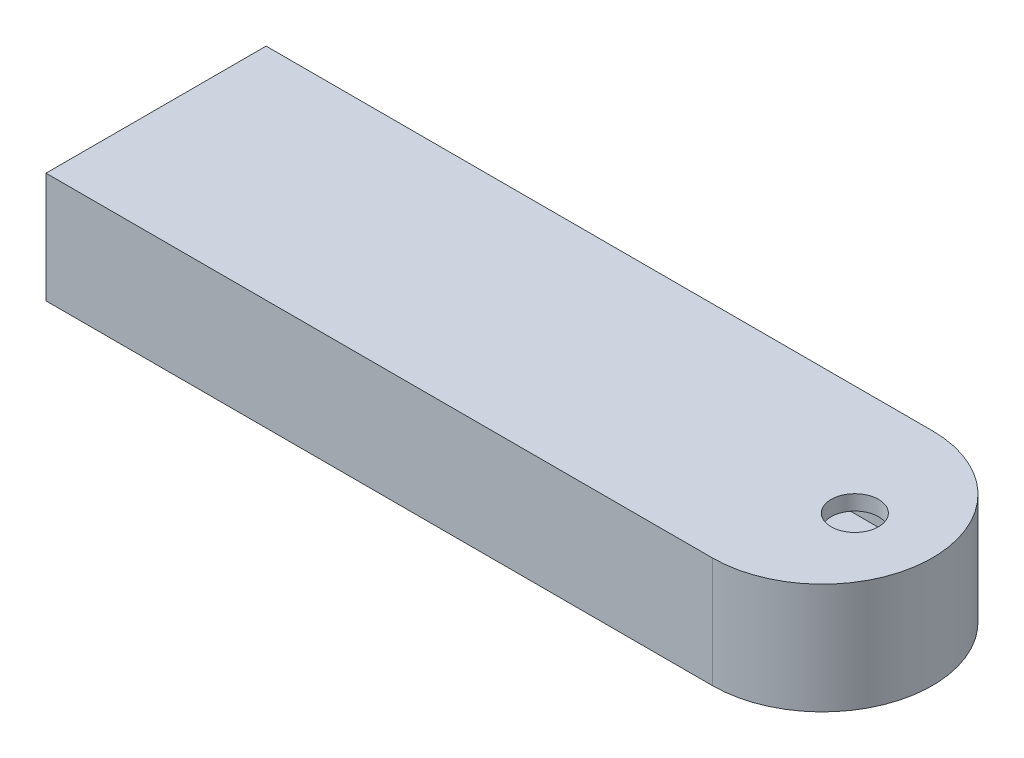
from build123d import *

# Parameters (mm, degrees)
SKETCH1_R           = 3.155
BOSS_EXTRUDE7_DEPTH = 14.7
SHELL1_T            = -2
CUT_EXTRUDE5_REACH  = 107.459
SKETCH4_W           = 25.25
SKETCH4_H           = 10.7


with BuildPart() as part:
    # Sketch1 → Boss-Extrude7 (new body)
    with BuildSketch(Plane(origin=(0, 0, 0), x_dir=(1, 0, 0), z_dir=(0, 1, 0))):
        with BuildLine():
            Line((-59.361665301, -13.110958237), (29.188334699, -13.110958237))
            ThreePointArc((29.188334699, -13.110958237), (43.813334699, 1.514041763), (29.188334699, 16.139041763))
            Line((29.188334699, 16.139041763), (-59.361665301, 16.139041763))
            Line((-59.361665301, 16.139041763), (-59.361665301, -13.110958237))
        make_face()
        with Locations(Location((33.498334699, 1.514041763, 0), (0, 0, 270))):
            Circle(SKETCH1_R, mode=Mode.SUBTRACT)
    extrude(amount=BOSS_EXTRUDE7_DEPTH)

    # Shell1
    shell1_openings = [part.faces().sort_by_distance(p)[0] for p in [
        (-59.361665301, 7.35, -1.514041763),
    ]]
    offset(amount=SHELL1_T, openings=shell1_openings, kind=Kind.INTERSECTION)

    # Sketch4 → Cut-Extrude5 (cut, up to next)
    with BuildSketch(Plane.ZY.offset(59.361665301), mode=Mode.PRIVATE) as cut_extrude5_sk1:
        with Locations((-1.514041763, 7.35)):
            Rectangle(SKETCH4_W, SKETCH4_H)
    cut_extrude5_tool1 = extrude(cut_extrude5_sk1.sketch, amount=-CUT_EXTRUDE5_REACH, mode=Mode.PRIVATE) & part.part
    add(cut_extrude5_tool1.solids().sort_by_distance((-59.361665, 7.35, -1.514042))[0], mode=Mode.SUBTRACT)


solid = part.part
